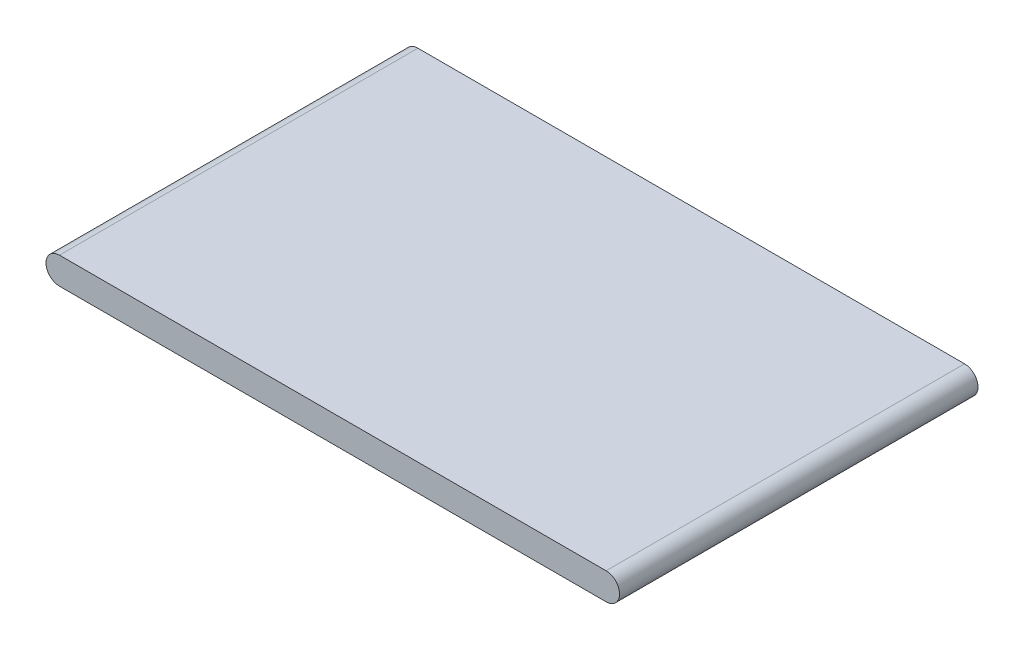
from build123d import *

# Parameters (mm, degrees)
BOSS_EXTRUDE1_DEPTH = 80


with BuildPart() as part:
    # Sketch1 → Boss-Extrude1 (new body)
    with BuildSketch(Plane.XY):
        with BuildLine():
            Line((0, 0), (122, 0))
            ThreePointArc((122, 0), (125, -3), (122, -6))
            Line((122, -6), (0, -6))
            ThreePointArc((0, -6), (-3, -3), (0, 0))
        make_face()
    extrude(amount=BOSS_EXTRUDE1_DEPTH)


solid = part.part
